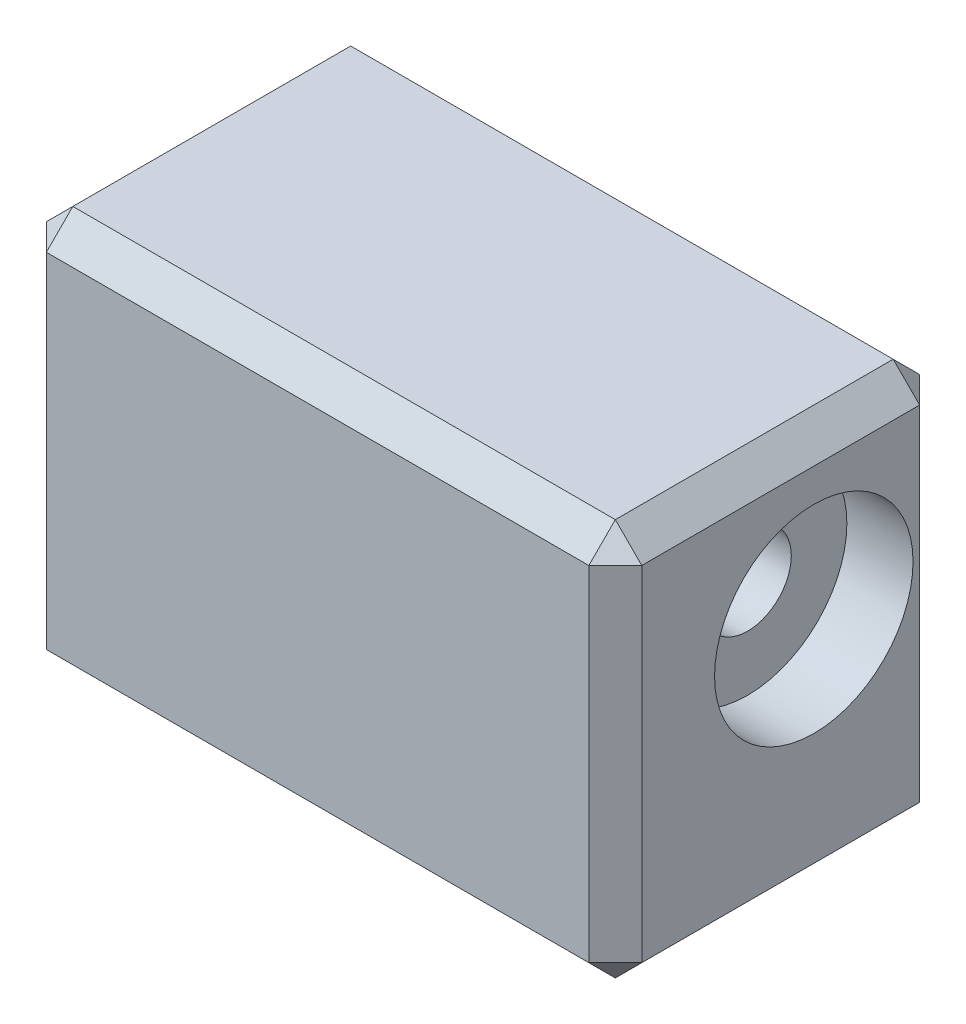
from build123d import *

# Parameters (mm, degrees)
ESTRUSIONE_ESTRUSIONE1_DEPTH                         = 30
SCHIZZO2_R                                           = 9.999999999999993
TAGLIO_ESTRUSIONE1_DEPTH                             = 18
FORO_LAMATO_PER_VITE_M6_A_TESTA_CILINDRI_D           = 6.6
FORO_LAMATO_PER_VITE_M6_A_TESTA_CILINDRI_DEPTH       = 80
FORO_LAMATO_PER_VITE_M6_A_TESTA_CILINDRI_CBORE_D     = 15
FORO_LAMATO_PER_VITE_M6_A_TESTA_CILINDRI_CBORE_DEPTH = 5
FORO_LAMATO_PER_VITE_M6_A_TESTA_CILINDRI_TIP         = 1.982840042790949
SMUSSO1_SIZE                                         = 2
SCHIZZO6_R                                           = 6.000000000000001
TAGLIO_ESTRUSIONE2_DEPTH                             = 3


with BuildPart() as part:
    # Schizzo1 → Estrusione-Estrusione1 (new body)
    with BuildSketch(Plane(origin=(0, 0, 0), x_dir=(1, 0, 0), z_dir=(0, 1, 0))):
        Polygon((0, 0), (-45, -6.12e-15), (-45, 24.999999999999993), (0, 25.000000000000004), align=None)
    extrude(amount=ESTRUSIONE_ESTRUSIONE1_DEPTH)

    # Schizzo2 → Taglio-Estrusione1 (cut)
    with BuildSketch(Plane(origin=(-5.78e-15, 0, -25.000000000000004), x_dir=(-1, 0, 2.1e-16), z_dir=(-2.1e-16, 0, -1))):
        with Locations((22.499999999999993, 18)):
            Circle(SCHIZZO2_R)
    extrude(amount=-TAGLIO_ESTRUSIONE1_DEPTH, mode=Mode.SUBTRACT)

    # Foro lamato per Vite M6 a testa cilindrica-1
    with Locations(Plane(origin=(0, 0, 0), x_dir=(0, 0, -1), z_dir=(1, 0, 0))):
        with Locations((15, 18)):
            CounterBoreHole(FORO_LAMATO_PER_VITE_M6_A_TESTA_CILINDRI_D / 2, FORO_LAMATO_PER_VITE_M6_A_TESTA_CILINDRI_CBORE_D / 2, FORO_LAMATO_PER_VITE_M6_A_TESTA_CILINDRI_CBORE_DEPTH, depth=FORO_LAMATO_PER_VITE_M6_A_TESTA_CILINDRI_DEPTH)
            with Locations((0, 0, -(FORO_LAMATO_PER_VITE_M6_A_TESTA_CILINDRI_DEPTH + FORO_LAMATO_PER_VITE_M6_A_TESTA_CILINDRI_TIP / 2))):  # 118° drill point
                Cone(0, FORO_LAMATO_PER_VITE_M6_A_TESTA_CILINDRI_D / 2, FORO_LAMATO_PER_VITE_M6_A_TESTA_CILINDRI_TIP, mode=Mode.SUBTRACT)

    # Smusso1
    smusso1_edges = [part.edges().sort_by_distance(p)[0] for p in [
        (-45, 30, -12.499999999999995),
        (-22.5, 30, 3.06e-15),
        (0, 30, -12.500000000000002),
        (-22.5, 0, 3.06e-15),
        (-45, 0, -12.499999999999995),
        (-22.5, 0, -25),
        (0, 0, -12.500000000000002),
        (0, 15, 0),
        (-45, 15, 6.12e-15),
        (-45, 15, -24.999999999999993),
        (0, 15, -25.000000000000004),
        (-22.5, 30, -25),
    ]]
    chamfer(smusso1_edges, length=SMUSSO1_SIZE)

    # Schizzo6 → Taglio-Estrusione2 (cut)
    with BuildSketch(Plane.ZY.offset(45)):
        with Locations((-15.000000000000005, 18)):
            Circle(SCHIZZO6_R)
    extrude(amount=-TAGLIO_ESTRUSIONE2_DEPTH, mode=Mode.SUBTRACT)


solid = part.part
